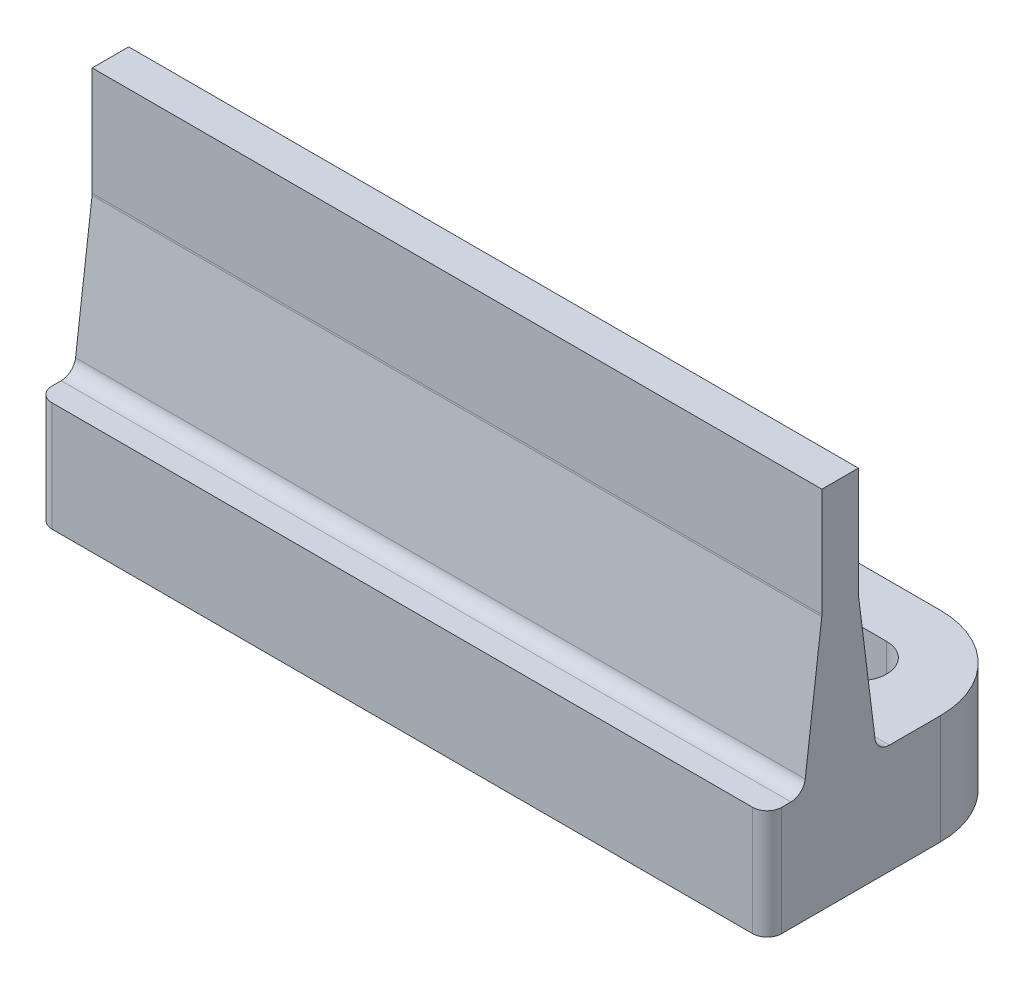
from build123d import *

# Parameters (mm, degrees)
BOSS_EXTRUDE1_DEPTH = 20
CUT_EXTRUDE1_REACH  = 28.575
FILLET1_R           = 5
FILLET2_R           = 0.79375


with BuildPart() as part:
    # Sketch1 → Boss-Extrude1 (new, symmetric)
    with BuildSketch(Plane(origin=(0, 0, 0), x_dir=(0, 0, -1), z_dir=(1, 0, 0))):
        Polygon((-4, 0), (10.5, 0), (10.5, 6), (2, 6), (1, 14), (1, 20), (-1, 20), (-1, 14), (-2, 6), (-4, 6), align=None)
    extrude(amount=BOSS_EXTRUDE1_DEPTH, both=True)

    # Sketch4 → Cut-Extrude1 (cut, up to next)
    with BuildSketch(Plane(origin=(0, 6, 0), x_dir=(1, 0, 0), z_dir=(0, 1, 0)), mode=Mode.PRIVATE) as cut_extrude1_sk1:
        with BuildLine():
            Line((-15, 7.55), (-5, 7.55))
            ThreePointArc((-5, 7.55), (-3.45, 6), (-5, 4.45))
            Line((-5, 4.45), (-15, 4.45))
            ThreePointArc((-15, 4.45), (-16.55, 6), (-15, 7.55))
        make_face()
    cut_extrude1_tool1 = extrude(cut_extrude1_sk1.sketch, amount=-CUT_EXTRUDE1_REACH, mode=Mode.PRIVATE) & part.part
    # Sketch4 → Cut-Extrude1 (cut, up to next)
    with BuildSketch(Plane(origin=(0, 6, 0), x_dir=(1, 0, 0), z_dir=(0, 1, 0)), mode=Mode.PRIVATE) as cut_extrude1_sk2:
        with BuildLine():
            Line((5, 7.55), (15, 7.55))
            ThreePointArc((15, 7.55), (16.55, 6), (15, 4.45))
            Line((15, 4.45), (5, 4.45))
            ThreePointArc((5, 4.45), (3.45, 6), (5, 7.55))
        make_face()
    cut_extrude1_tool2 = extrude(cut_extrude1_sk2.sketch, amount=-CUT_EXTRUDE1_REACH, mode=Mode.PRIVATE) & part.part
    add(cut_extrude1_tool1.solids().sort_by_distance((-10, 6, -6))[0], mode=Mode.SUBTRACT)
    add(cut_extrude1_tool2.solids().sort_by_distance((10, 6, -6))[0], mode=Mode.SUBTRACT)

    # Fillet1
    fillet1_edges = [part.edges().sort_by_distance(p)[0] for p in [
        (20, 3, -10.5),
        (-20, 3, -10.5),
    ]]
    fillet(fillet1_edges, radius=FILLET1_R)

    # Fillet2
    fillet2_edges = [part.edges().sort_by_distance(p)[0] for p in [
        (-20, 3, 4),
        (0, 6, 2),
        (0, 14, 1),
        (0, 14, -1),
        (0, 6, -2),
        (20, 3, 4),
    ]]
    fillet(fillet2_edges, radius=FILLET2_R)


solid = part.part
